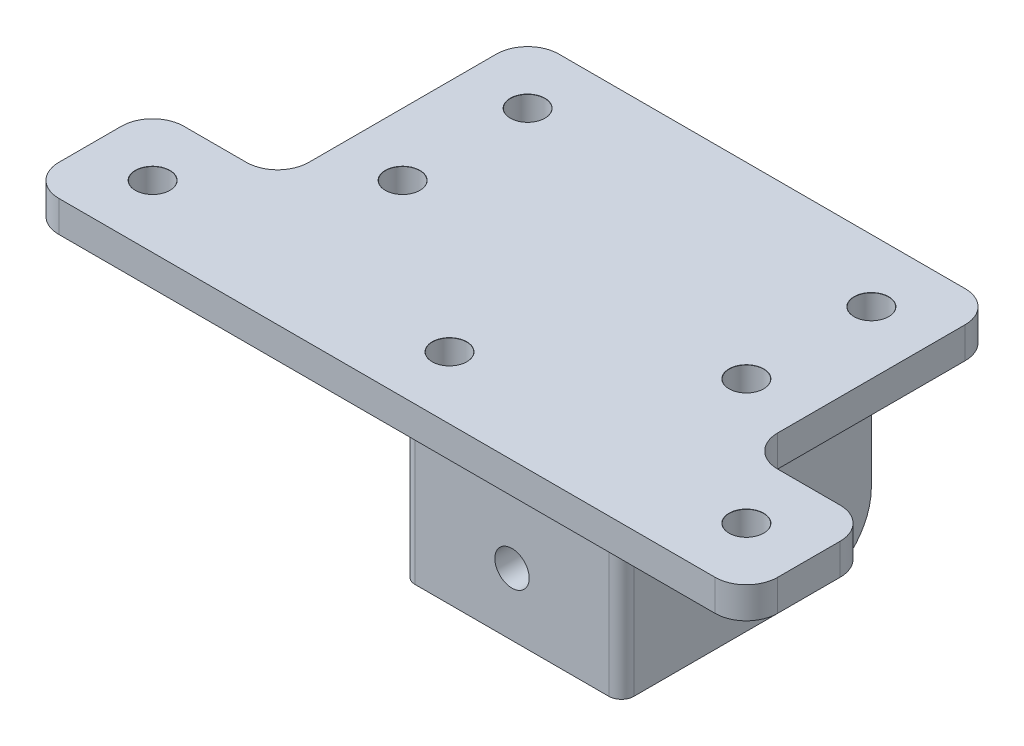
from build123d import *

# Parameters (mm, degrees)
BOSS_EXTRUDE1_DEPTH            = 5
BOSS_EXTRUDE2_DEPTH            = 40
M5_CLEARANCE_HOLE1_D           = 5.5
M5_CLEARANCE_HOLE1_CSINK_D     = 5.55
M5_CLEARANCE_HOLE1_CSINK_ANGLE = 90
M5_CLEARANCE_HOLE2_D           = 5.5
M5_CLEARANCE_HOLE2_CSINK_D     = 5.55
M5_CLEARANCE_HOLE2_CSINK_ANGLE = 90
FILLET1_R                      = 2
M5_CLEARANCE_HOLE3_D           = 5.5
M5_CLEARANCE_HOLE3_CSINK_D     = 5.55
M5_CLEARANCE_HOLE3_CSINK_ANGLE = 90
FILLET2_R                      = 5
M5_CLEARANCE_HOLE4_D           = 5.5
M5_CLEARANCE_HOLE4_CSINK_D     = 5.55
M5_CLEARANCE_HOLE4_CSINK_ANGLE = 90
M5_CLEARANCE_HOLE5_D           = 5.5
M5_CLEARANCE_HOLE5_CSINK_D     = 5.55
M5_CLEARANCE_HOLE5_CSINK_ANGLE = 90
FILLET3_R                      = 10


with BuildPart() as part:
    # Sketch2 → Boss-Extrude1 (new body)
    with BuildSketch(Plane(origin=(0, 0, 0), x_dir=(1, 0, 0), z_dir=(0, 1, 0))):
        Polygon((-57.5, 0), (57.5, 0), (57.5, 20), (37.5, 20), (37.5, 60), (-37.5, 60), (-37.5, 20), (-57.5, 20), align=None)
    extrude(amount=BOSS_EXTRUDE1_DEPTH)

    # Sketch3 → Boss-Extrude2 (add)
    with BuildSketch(Plane.XZ):
        Polygon((17.5, -60), (17.5, -20), (-17.5, -20), (-17.5, -60), (-12.5, -60), (-13.096167181, -25), (12.5, -25), (12.5, -60), align=None)
    extrude(amount=BOSS_EXTRUDE2_DEPTH)

    # M5 Clearance Hole1 (through all)
    with Locations(Plane(origin=(-27.5, 5, -50), x_dir=(0, 0, 1), z_dir=(0, 1, 0))):
        with Locations((0, 0), (20, 0)):
            m5_clearance_hole1 = CounterSinkHole(M5_CLEARANCE_HOLE1_D / 2, M5_CLEARANCE_HOLE1_CSINK_D / 2, counter_sink_angle=M5_CLEARANCE_HOLE1_CSINK_ANGLE)

    # Mirror1: M5 Clearance Hole1 across plane
    add(m5_clearance_hole1.mirror(Plane(origin=(0, 0, 0), x_dir=(0, 0, 1), z_dir=(1, 0, 0))), mode=Mode.SUBTRACT)

    # M5 Clearance Hole2 (through all)
    with Locations(Plane(origin=(-47.5, 5, -10), x_dir=(0, 0, 1), z_dir=(0, 1, 0))):
        with Locations((0, 0)):
            m5_clearance_hole2 = CounterSinkHole(M5_CLEARANCE_HOLE2_D / 2, M5_CLEARANCE_HOLE2_CSINK_D / 2, counter_sink_angle=M5_CLEARANCE_HOLE2_CSINK_ANGLE)

    # Mirror2: M5 Clearance Hole2 across plane
    add(m5_clearance_hole2.mirror(Plane(origin=(0, 0, 0), x_dir=(0, 0, 1), z_dir=(1, 0, 0))), mode=Mode.SUBTRACT)

    # Fillet1
    fillet1_edges = [part.edges().sort_by_distance(p)[0] for p in [
        (17.5, -20, -20),
        (-17.5, -20, -20),
    ]]
    fillet(fillet1_edges, radius=FILLET1_R)

    # M5 Clearance Hole3 (through all)
    with Locations(Plane(origin=(0, -30, -25), x_dir=(-1, 0, 0), z_dir=(0, 0, -1))):
        with Locations((0, 0)):
            CounterSinkHole(M5_CLEARANCE_HOLE3_D / 2, M5_CLEARANCE_HOLE3_CSINK_D / 2, counter_sink_angle=M5_CLEARANCE_HOLE3_CSINK_ANGLE)

    # Fillet2
    fillet2_edges = [part.edges().sort_by_distance(p)[0] for p in [
        (37.5, 2.5, -20),
        (57.5, 2.5, -20),
        (57.5, 2.5, 0),
        (-57.5, 2.5, 0),
        (-57.5, 2.5, -20),
        (-37.5, 2.5, -20),
        (-37.5, 2.5, -60),
        (37.5, 2.5, -60),
    ]]
    fillet(fillet2_edges, radius=FILLET2_R)

    # M5 Clearance Hole4 (through all)
    with Locations(Plane(origin=(0, 5, -10), x_dir=(0, 0, 1), z_dir=(0, 1, 0))):
        with Locations((0, 0)):
            CounterSinkHole(M5_CLEARANCE_HOLE4_D / 2, M5_CLEARANCE_HOLE4_CSINK_D / 2, counter_sink_angle=M5_CLEARANCE_HOLE4_CSINK_ANGLE)

    # M5 Clearance Hole5 (through all)
    with Locations(Plane(origin=(-17.5, -30, -50), x_dir=(0, 0, -1), z_dir=(-1, 0, 0))):
        with Locations((0, 0)):
            CounterSinkHole(M5_CLEARANCE_HOLE5_D / 2, M5_CLEARANCE_HOLE5_CSINK_D / 2, counter_sink_angle=M5_CLEARANCE_HOLE5_CSINK_ANGLE)

    # Fillet3
    fillet3_edges = [part.edges().sort_by_distance(p)[0] for p in [
        (15, -40, -60),
        (-15, -40, -60),
    ]]
    fillet(fillet3_edges, radius=FILLET3_R)


solid = part.part
